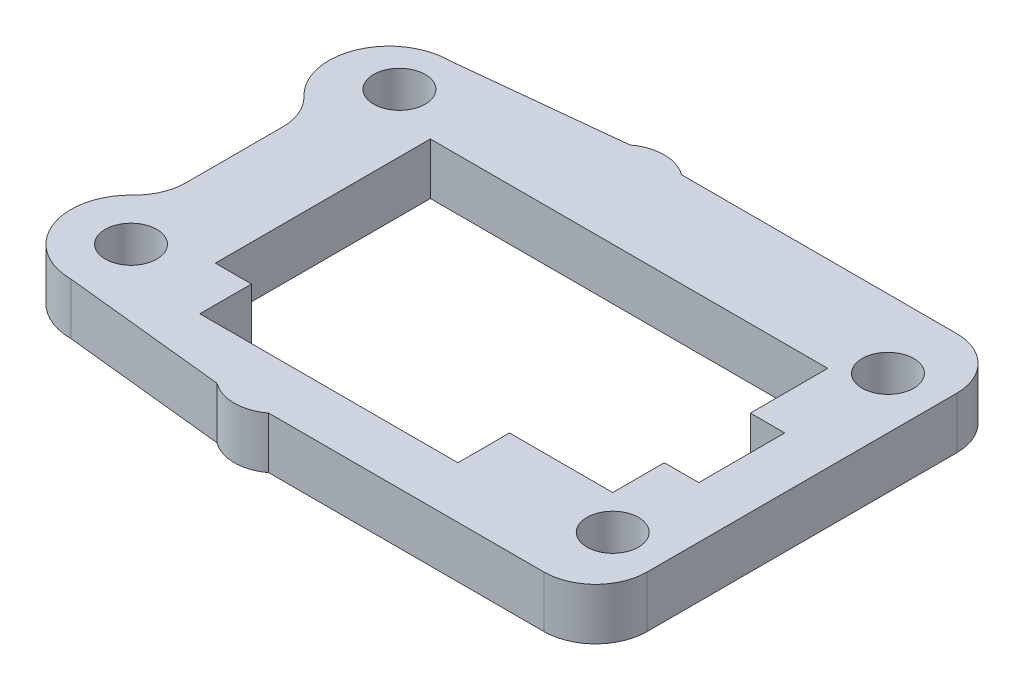
from build123d import *

# Parameters (mm, degrees)
CROQUIS1_R                 = 1.5
SALIENTE_EXTRUIR1_DEPTH    = 3
S_LIDO_MOVER_COPIAR1_ANGLE = 90


with BuildPart() as part:
    # Croquis1 → Saliente-Extruir1 (new body)
    with BuildSketch(Plane.XY):
        with BuildLine():
            Line((41558.361281649, 58239.957618209), (41574.361281649, 58239.957618209))
            ThreePointArc((41574.361281649, 58239.957618209), (41576.482601992, 58239.078938552), (41577.361281649, 58236.957618209))
            Line((41577.361281649, 58236.957618209), (41577.361281649, 58218.957618209))
            ThreePointArc((41577.361281649, 58218.957618209), (41576.482601992, 58216.836297865), (41574.361281649, 58215.957618209))
            Line((41574.361281649, 58215.957618209), (41558.361281649, 58215.957618209))
            ThreePointArc((41558.361281649, 58215.957618209), (41556.861281649, 58215.457618209), (41555.361281649, 58215.957618209))
            Line((41555.361281649, 58215.957618209), (41545.861281649, 58216.957618209))
            ThreePointArc((41545.861281649, 58216.957618209), (41542.614003581, 58219.151790828), (41543.438204726, 58222.983226695))
            ThreePointArc((41543.438204726, 58222.983226695), (41544.120880282, 58223.971337158), (41544.361281649, 58225.148033968))
            Line((41544.361281649, 58225.148033968), (41544.361281649, 58230.767202449))
            ThreePointArc((41544.361281649, 58230.767202449), (41544.120880282, 58231.94389926), (41543.438204726, 58232.932009723))
            ThreePointArc((41543.438204726, 58232.932009723), (41542.614003581, 58236.76344559), (41545.86128165, 58238.957618209))
            Line((41545.86128165, 58238.957618209), (41555.361281649, 58239.957618209))
            ThreePointArc((41555.361281649, 58239.957618209), (41556.861281649, 58240.457618209), (41558.361281649, 58239.957618209))
        make_face()
        with Locations((41545.861281649, 58235.457618209)):
            Circle(CROQUIS1_R, mode=Mode.SUBTRACT)
        with Locations((41545.861281649, 58219.857618209)):
            Circle(CROQUIS1_R, mode=Mode.SUBTRACT)
        with Locations((41574.361281649, 58219.957618209)):
            Circle(CROQUIS1_R, mode=Mode.SUBTRACT)
        with Locations((41574.361281649, 58235.957618209)):
            Circle(CROQUIS1_R, mode=Mode.SUBTRACT)
        Polygon((41551.361281649, 58236.957618209), (41566.361281649, 58236.957618209), (41566.361281649, 58233.957618209), (41572.361281649, 58233.957618209), (41572.361281649, 58230.957618209), (41574.361281649, 58230.957618209), (41574.361281649, 58225.957618209), (41572.361281649, 58225.957618209), (41572.361281649, 58221.457618208), (41549.261281649, 58221.457618208), (41549.261281649, 58233.957618209), (41551.361281649, 58233.957618209), align=None, mode=Mode.SUBTRACT)
    extrude(amount=SALIENTE_EXTRUIR1_DEPTH)


with BuildPart() as part_1:
    # Sólido-Mover/Copiar1: moved
    add(part.part.rotate(Axis((0, 58227.957618209, 1.5), (1, 0, 0)), S_LIDO_MOVER_COPIAR1_ANGLE))


solid = part_1.part
